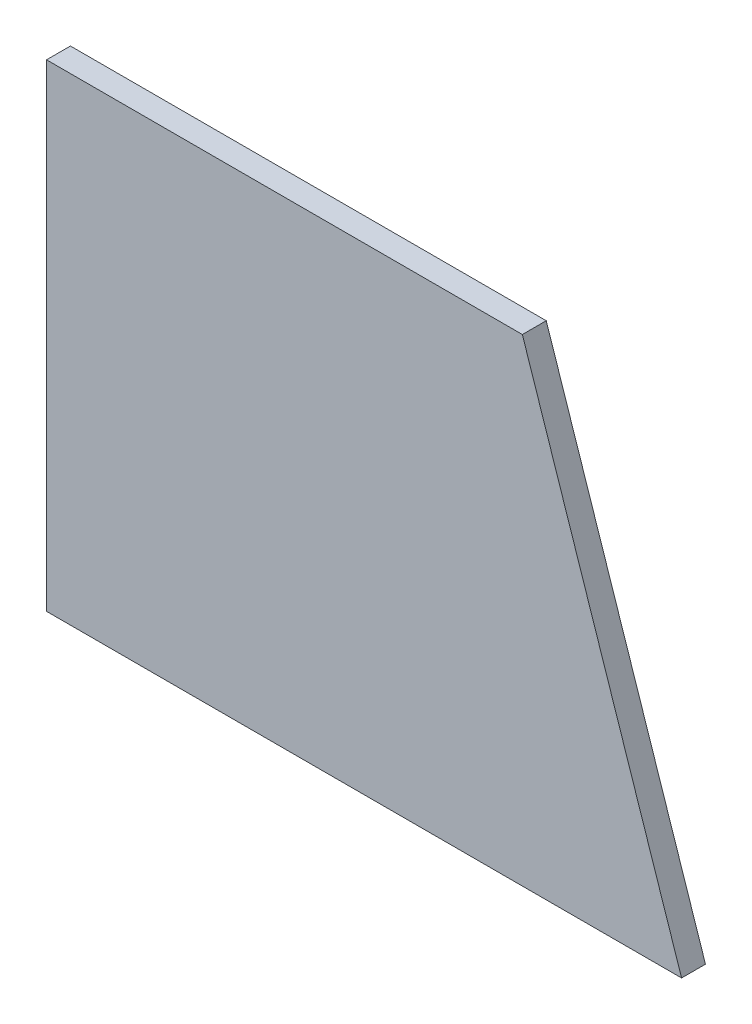
from build123d import *

# Parameters (mm, degrees)
BOSS_EXTRUDE1_DEPTH = 0.015


with BuildPart() as part:
    # Sketch2 → Boss-Extrude1 (new, symmetric)
    with BuildSketch(Plane.XY):
        Polygon((0, 0.35), (0.297683813, 0.35), (0.497683813, -0.25), (-0.3, -0.25), (-0.3, 0.35), align=None)
    extrude(amount=BOSS_EXTRUDE1_DEPTH, both=True)


solid = part.part
